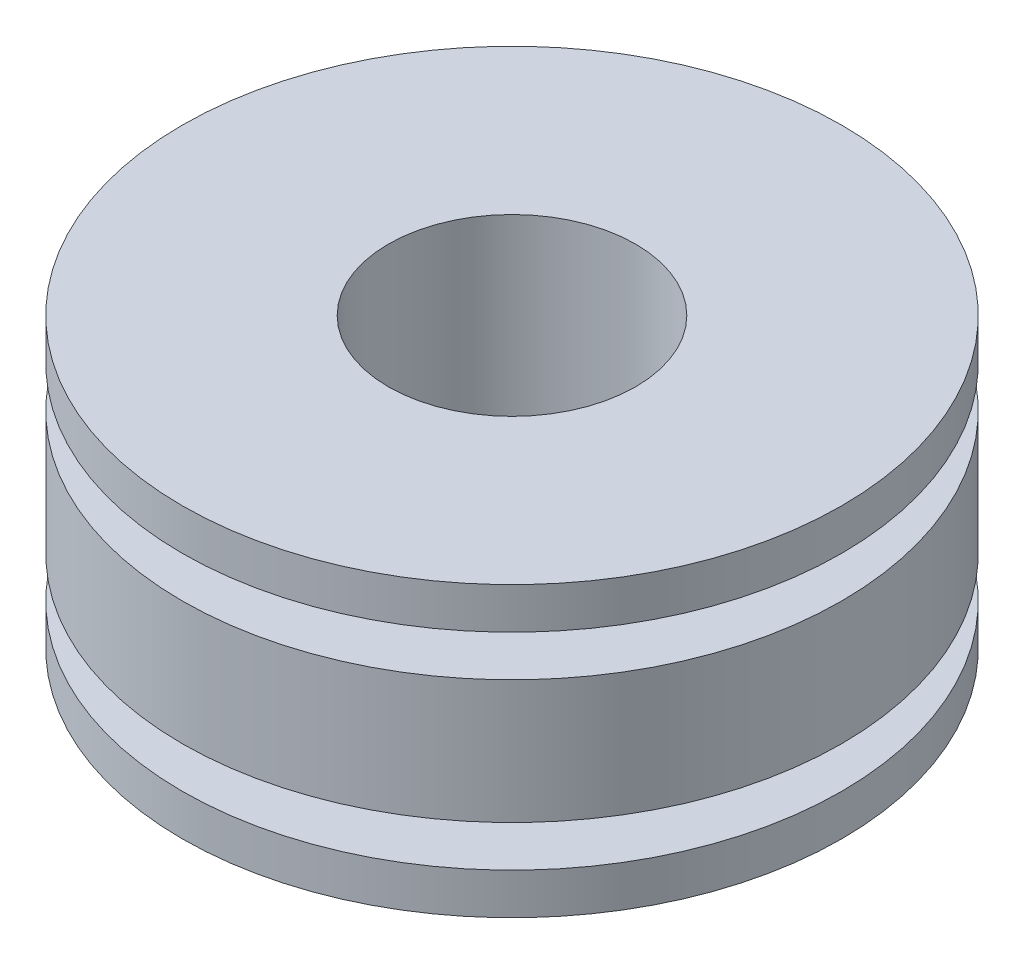
from build123d import *


with BuildPart() as part:
    # 草图1 → 旋转1 (revolve)
    with BuildSketch(Plane.XY, mode=Mode.PRIVATE) as revolve_1_sk:
        Polygon((1.5, 3.5), (1.5, 1.75), (4, 1.75), (4, 2.5), (3, 2.5), (3, 3), (4, 3), (4, 3.5), align=None)
        Polygon((1.5, 1.75), (1.5, 0), (4, 0), (4, 0.5), (3, 0.5), (3, 1), (4, 1), (4, 1.75), align=None)
    revolve(revolve_1_sk.sketch.rotate(Axis((0, 0, 0), (0, 1, 0)), 90), axis=Axis((0, 0, 0), (0, 1, 0)))


solid = part.part
